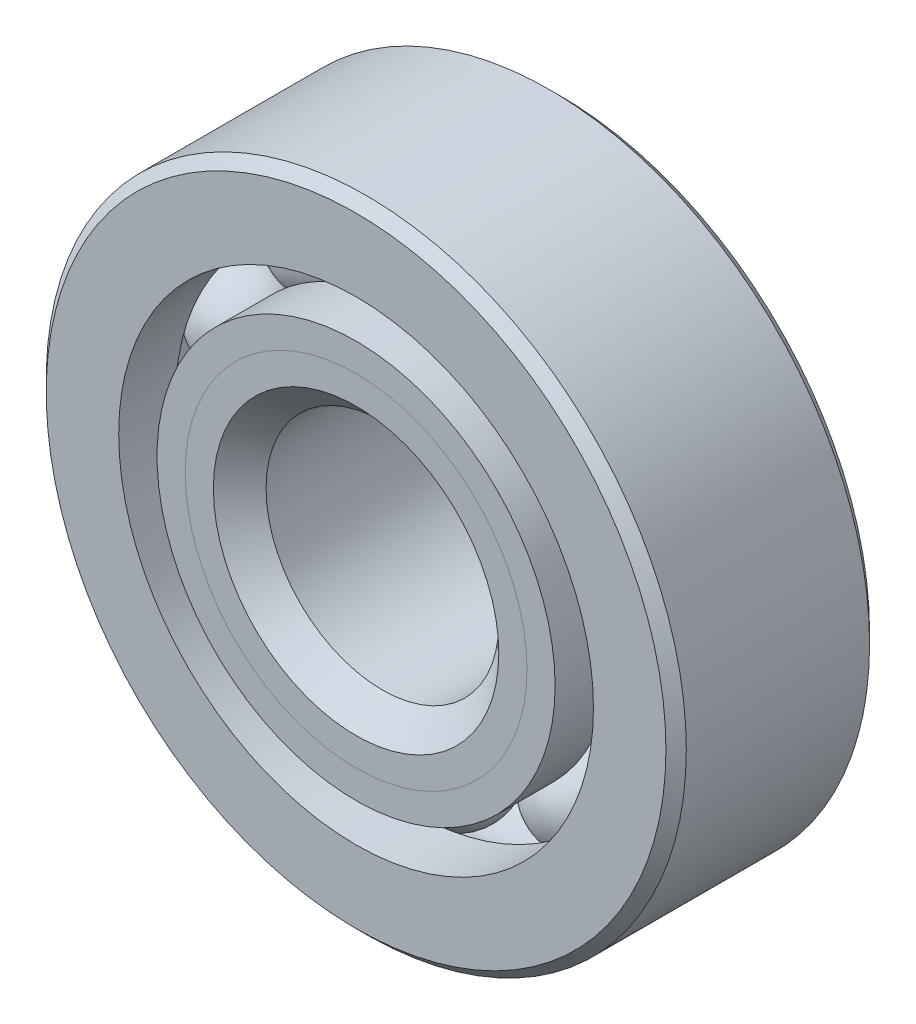
from build123d import *

# Parameters (mm, degrees)
CIRPATTERN1_COUNT = 10


with BuildPart() as part:
    # Sketch1 → Revolve1 (revolve)
    with BuildSketch(Plane(origin=(0, 0, 0), x_dir=(0, 0, -1), z_dir=(1, 0, 0)), mode=Mode.PRIVATE) as revolve1_sk:
        with BuildLine():
            Line((3.15, 11), (-3.15, 11))
            Line((-3.15, 11), (-3.5, 10.65))
            Line((-3.5, 10.65), (-3.5, 8.159340659))
            Line((-3.5, 8.159340659), (-1.555555556, 8.159340659))
            ThreePointArc((-1.555555556, 8.159340659), (0, 9.189521587), (1.555555556, 8.159340659))
            Line((1.555555556, 8.159340659), (3.5, 8.159340659))
            Line((3.5, 8.159340659), (3.5, 10.65))
            Line((3.5, 10.65), (3.15, 11))
        make_face()
    revolve(revolve1_sk.sketch.rotate(Axis((0, 0, 3.5), (0, 0, -1)), 90), axis=Axis((0, 0, 3.5), (0, 0, -1)))


with BuildPart() as body_2:
    # Sketch2 → Revolve2 (revolve)
    with BuildSketch(Plane(origin=(0, 0, 0), x_dir=(0, 0, -1), z_dir=(1, 0, 0)), mode=Mode.PRIVATE) as revolve2_sk:
        with BuildLine():
            Line((-3.5, 6.840659341), (-1.555555556, 6.840659341))
            ThreePointArc((-1.555555556, 6.840659341), (-0.932875371, 6.091374168), (0, 5.810478413))
            Line((0, 5.810478413), (0, 4.905239207))
            Line((0, 4.905239207), (-2.532289933, 4.905239207))
            Line((-2.532289933, 4.905239207), (-3.5, 5.872949274))
            Line((-3.5, 5.872949274), (-3.5, 6.840659341))
        make_face()
    revolve(revolve2_sk.sketch.rotate(Axis((0, 0, 3.5), (0, 0, -1)), 90), axis=Axis((0, 0, 3.5), (0, 0, -1)))


with BuildPart() as body_3:
    # Sketch3 → Revolve3 (revolve)
    with BuildSketch(Plane(origin=(0, 0, 0), x_dir=(0, 0, -1), z_dir=(1, 0, 0)), mode=Mode.PRIVATE) as revolve3_sk:
        with BuildLine():
            Line((-3.5, 5.872949274), (-2.532289933, 4.905239207))
            Line((-2.532289933, 4.905239207), (0, 4.905239207))
            Line((0, 4.905239207), (0, 5.810478413))
            ThreePointArc((0, 5.810478413), (0.932875371, 6.091374168), (1.555555556, 6.840659341))
            Line((1.555555556, 6.840659341), (3.5, 6.840659341))
            Line((3.5, 6.840659341), (3.5, 4.35))
            Line((3.5, 4.35), (3.15, 4))
            Line((3.15, 4), (-2.594760793, 4))
            Line((-2.594760793, 4), (-3.5, 4.905239207))
            Line((-3.5, 4.905239207), (-3.5, 5.872949274))
        make_face()
    revolve(revolve3_sk.sketch.rotate(Axis((0, 0, 3.5), (0, 0, -1)), 90), axis=Axis((0, 0, 3.5), (0, 0, -1)))


with BuildPart() as body_4:
    # Sketch4 → Revolve4 (revolve)
    with BuildSketch(Plane(origin=(0, 0, 0), x_dir=(0, 0, -1), z_dir=(1, 0, 0))):
        with BuildLine():
            Line((-1.689521587, 7.5), (1.689521587, 7.5))
            ThreePointArc((1.689521587, 7.5), (0, 9.189521587), (-1.689521587, 7.5))
        make_face()
    revolve(axis=Axis((0, 7.5, 1.689521587), (0, 0, -1)))


with BuildPart() as cirpattern1_1:
    # CirPattern1: pattern copy
    add(body_4.part.rotate(Axis((0, 0, 0), (0, 0, 1)), 1 * 360 / CIRPATTERN1_COUNT))


with BuildPart() as cirpattern1_2:
    # CirPattern1: pattern copy
    add(body_4.part.rotate(Axis((0, 0, 0), (0, 0, 1)), 2 * 360 / CIRPATTERN1_COUNT))


with BuildPart() as cirpattern1_3:
    # CirPattern1: pattern copy
    add(body_4.part.rotate(Axis((0, 0, 0), (0, 0, 1)), 3 * 360 / CIRPATTERN1_COUNT))


with BuildPart() as cirpattern1_4:
    # CirPattern1: pattern copy
    add(body_4.part.rotate(Axis((0, 0, 0), (0, 0, 1)), 4 * 360 / CIRPATTERN1_COUNT))


with BuildPart() as cirpattern1_5:
    # CirPattern1: pattern copy
    add(body_4.part.rotate(Axis((0, 0, 0), (0, 0, 1)), 5 * 360 / CIRPATTERN1_COUNT))


with BuildPart() as cirpattern1_6:
    # CirPattern1: pattern copy
    add(body_4.part.rotate(Axis((0, 0, 0), (0, 0, 1)), 6 * 360 / CIRPATTERN1_COUNT))


with BuildPart() as cirpattern1_7:
    # CirPattern1: pattern copy
    add(body_4.part.rotate(Axis((0, 0, 0), (0, 0, 1)), 7 * 360 / CIRPATTERN1_COUNT))


with BuildPart() as cirpattern1_8:
    # CirPattern1: pattern copy
    add(body_4.part.rotate(Axis((0, 0, 0), (0, 0, 1)), 8 * 360 / CIRPATTERN1_COUNT))


with BuildPart() as cirpattern1_9:
    # CirPattern1: pattern copy
    add(body_4.part.rotate(Axis((0, 0, 0), (0, 0, 1)), 9 * 360 / CIRPATTERN1_COUNT))


solid = Compound([part.part, body_2.part, body_3.part, body_4.part, cirpattern1_1.part, cirpattern1_2.part, cirpattern1_3.part, cirpattern1_4.part, cirpattern1_5.part, cirpattern1_6.part, cirpattern1_7.part, cirpattern1_8.part, cirpattern1_9.part])
